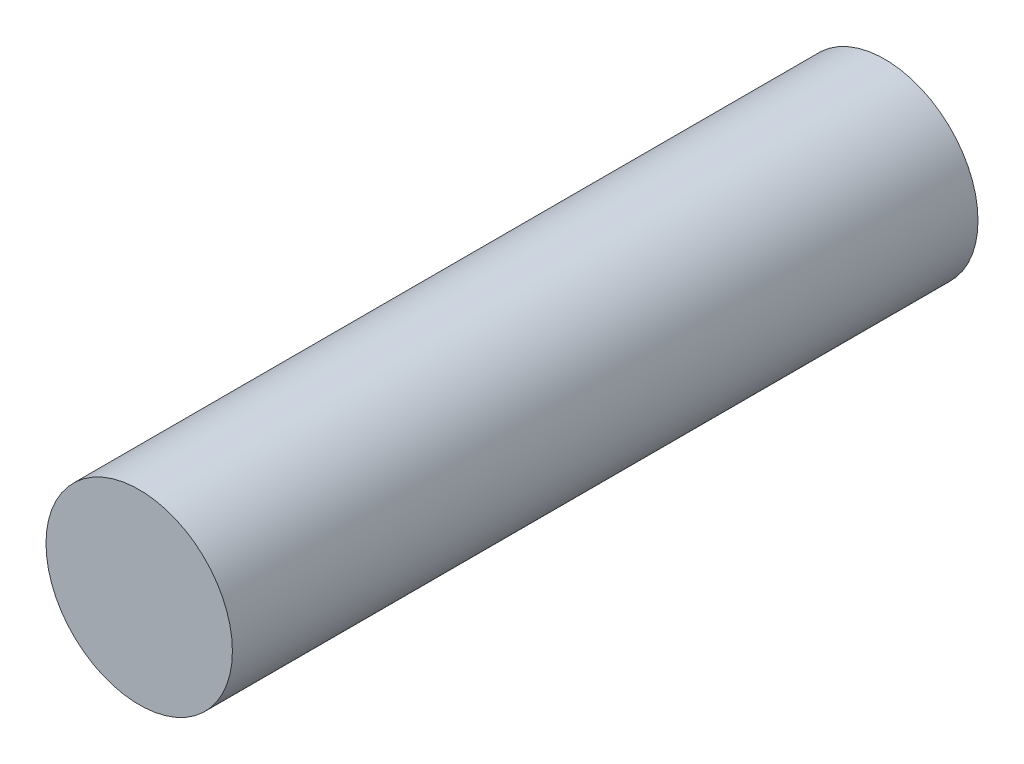
from build123d import *

# Parameters (mm, degrees)
SKETCH1_R           = 4.7625
BOSS_EXTRUDE1_DEPTH = 38.1


with BuildPart() as part:
    # Sketch1 → Boss-Extrude1 (new body)
    with BuildSketch(Plane.XY):
        with Locations(Location((0, 0, 0), (0, 0, 180))):
            Circle(SKETCH1_R)
    extrude(amount=BOSS_EXTRUDE1_DEPTH)


solid = part.part
